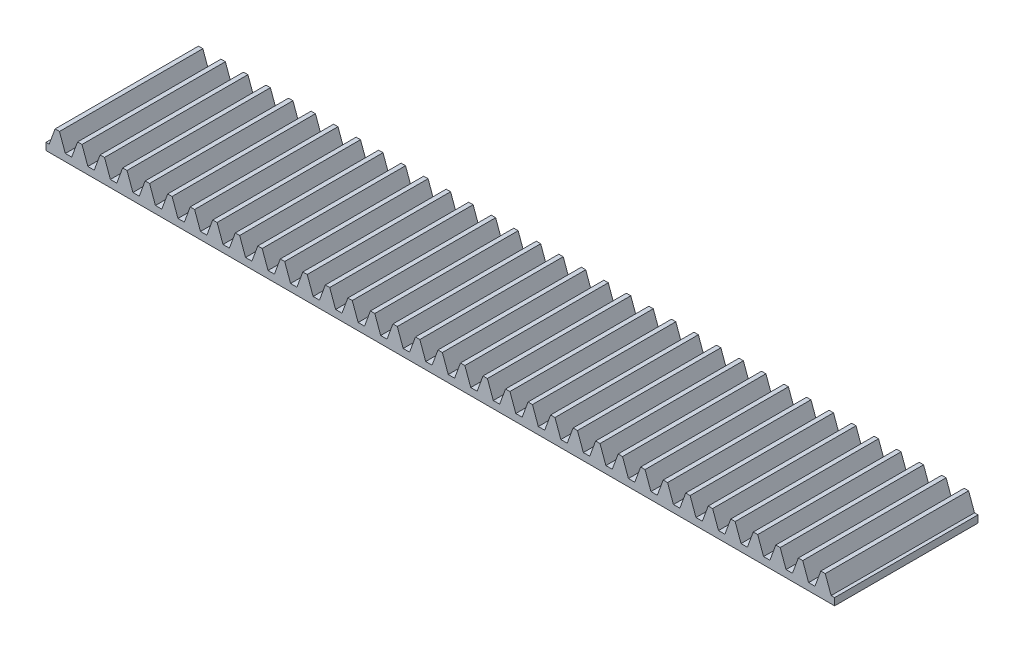
from build123d import *

# Parameters (mm, degrees)
BLANKSKE_W        = 110
BLANKSKE_H        = 3.25
BLANK_DEPTH       = 20
TOOTHCUTSIM_DEPTH = 112.850625836
TEETHCUTS_COUNT   = 36
TEETHCUTS_PITCH   = 3.14159265


with BuildPart() as part:
    # BlankSke → Blank (new body)
    with BuildSketch(Plane.XY):
        with Locations((55, 1.625)):
            Rectangle(BLANKSKE_W, BLANKSKE_H)
    extrude(amount=-BLANK_DEPTH)

    # TooCutSkeSim → ToothCutSim (cut, through all)
    with BuildSketch(Plane.XY):
        Polygon((0.44443537, 1), (-0.44443537, 1), (-1.272613241, 3.2754), (1.272613241, 3.2754), align=None)
    toothcutsim = extrude(amount=-TOOTHCUTSIM_DEPTH, mode=Mode.SUBTRACT)

    # TeethCuts: ToothCutSim ×36
    with Locations(*[(i * TEETHCUTS_PITCH, 0, 0) for i in range(1, TEETHCUTS_COUNT)]):
        add(toothcutsim, mode=Mode.SUBTRACT)


solid = part.part
